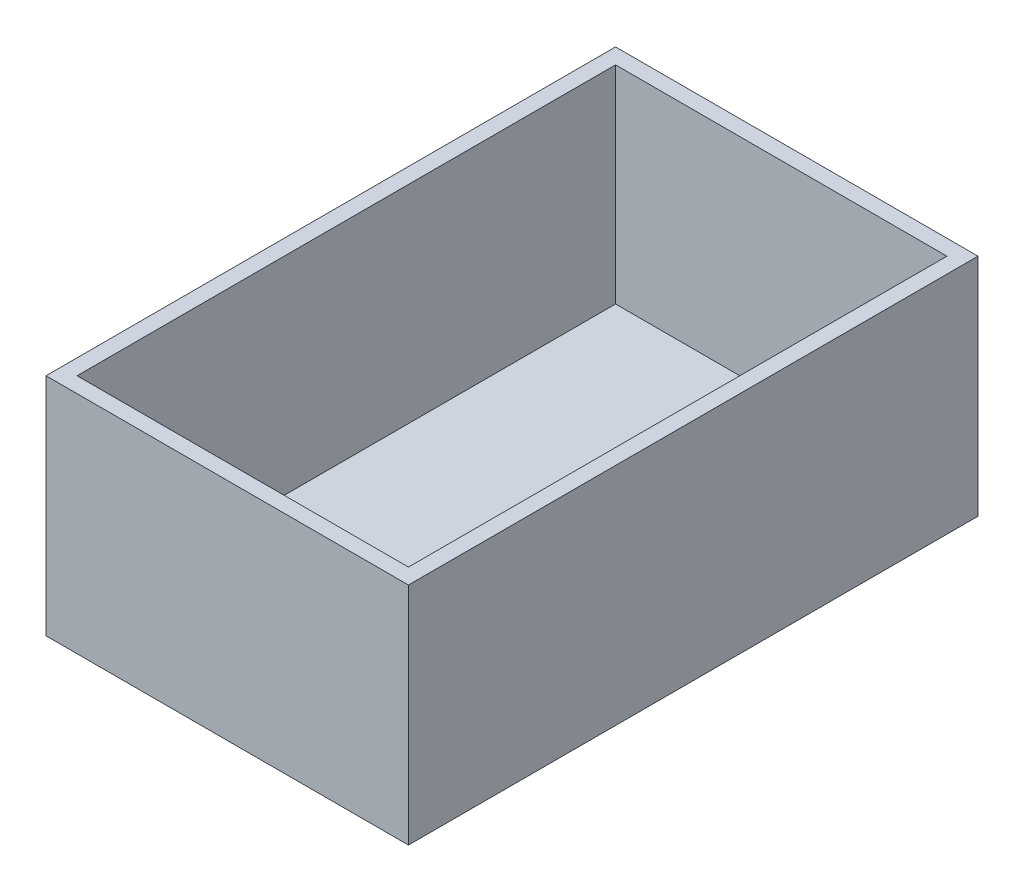
from build123d import *

# Parameters (mm, degrees)
BASE_PLATE_W         = 70
BASE_PLATE_H         = 110
BASE_PLATE_EXT_DEPTH = 3.5
WALL_W               = 70
WALL_H               = 110
WALL_W_2             = 64
WALL_H_2             = 104
WALL_EXT_DEPTH       = 40


with BuildPart() as part:
    # Base plate → Base plate EXT (new body)
    with BuildSketch(Plane(origin=(0, 0, 0), x_dir=(1, 0, 0), z_dir=(0, 1, 0))):
        Rectangle(BASE_PLATE_W, BASE_PLATE_H)
    extrude(amount=BASE_PLATE_EXT_DEPTH)

    # Wall → Wall Ext (add)
    with BuildSketch(Plane(origin=(0, 3.5, 0), x_dir=(1, 0, 0), z_dir=(0, 1, 0))):
        Rectangle(WALL_W, WALL_H)
        Rectangle(WALL_W_2, WALL_H_2, mode=Mode.SUBTRACT)
    extrude(amount=WALL_EXT_DEPTH)


solid = part.part
